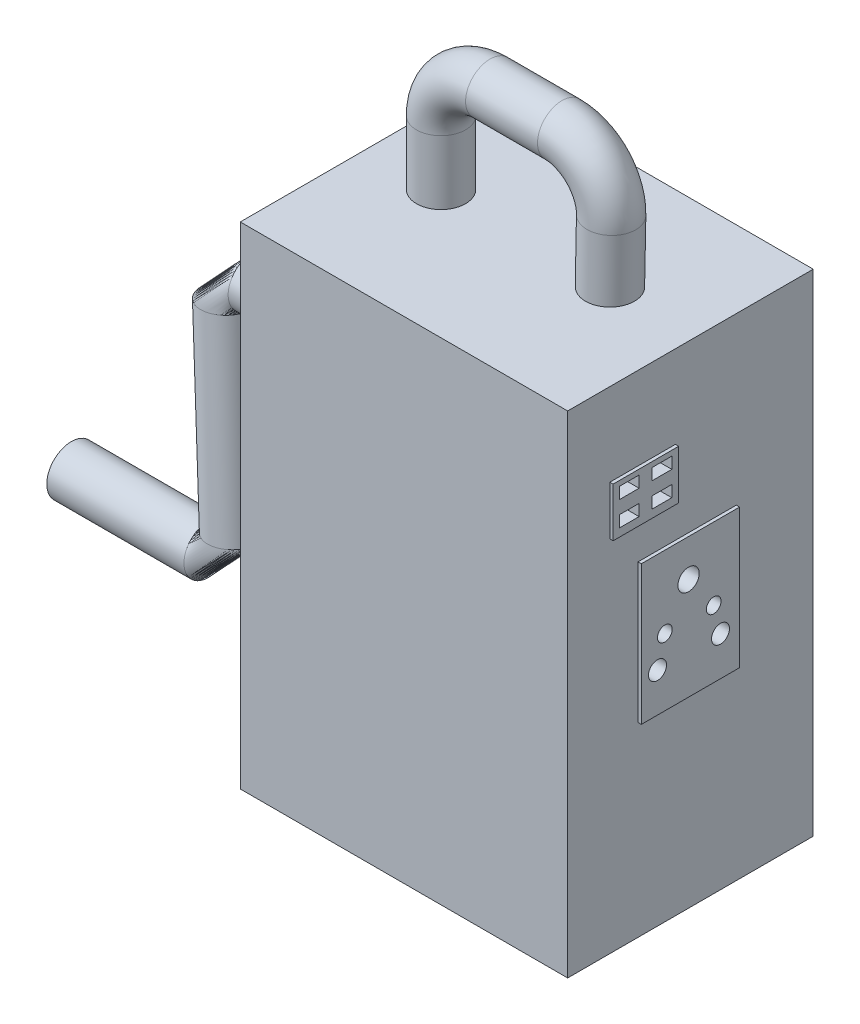
from build123d import *

# Parameters (mm, degrees)
SKETCH1_W            = 200
SKETCH1_H            = 150
BOSS_EXTRUDE1_DEPTH  = 300
SKETCH2_R            = 10
BOSS_EXTRUDE2_DEPTH  = 10
LPATTERN1_COUNT      = 2
LPATTERN1_PITCH      = 135
LPATTERN1_COUNT_DIR2 = 2
LPATTERN1_PITCH_DIR2 = 95
SKETCH3_W            = 60
SKETCH3_H            = 85
BOSS_EXTRUDE3_DEPTH  = 2
SKETCH4_R            = 6.5
SKETCH4_R_2          = 4.5
SKETCH4_R_3          = 5.5
CUT_EXTRUDE1_DEPTH   = 10
SKETCH5_W            = 40
SKETCH5_H            = 30
BOSS_EXTRUDE4_DEPTH  = 2
SKETCH6_W            = 12
SKETCH6_H            = 7
CUT_EXTRUDE2_DEPTH   = 10
LPATTERN2_COUNT      = 2
LPATTERN2_PITCH      = 20
LPATTERN2_COUNT_DIR2 = 2
LPATTERN2_PITCH_DIR2 = 15
SWEEP1_PROFILE_R     = 15
SWEEP3_PROFILE_R     = 15


with BuildPart() as part:
    # Sketch1 → Boss-Extrude1 (new body)
    with BuildSketch(Plane(origin=(0, 0, 0), x_dir=(1, 0, 0), z_dir=(0, 1, 0))):
        with Locations((100, 75)):
            Rectangle(SKETCH1_W, SKETCH1_H)
    extrude(amount=BOSS_EXTRUDE1_DEPTH)

    # Sketch2 → Boss-Extrude2 (add)
    with BuildSketch(Plane.XZ):
        with Locations(Location((30, -30, 0), (0, 0, 270))):
            Circle(SKETCH2_R)
    boss_extrude2 = extrude(amount=BOSS_EXTRUDE2_DEPTH)

    # LPattern1: Boss-Extrude2 2 × 2
    with Locations(*[(i * LPATTERN1_PITCH, 0, -j * LPATTERN1_PITCH_DIR2) for i in range(LPATTERN1_COUNT) for j in range(LPATTERN1_COUNT_DIR2) if (i, j) != (0, 0)]):
        add(boss_extrude2)

    # Sketch3 → Boss-Extrude3 (add)
    with BuildSketch(Plane(origin=(200, 0, 0), x_dir=(0, 0, -1), z_dir=(1, 0, 0))):
        with Locations((73, 156.159254336)):
            Rectangle(SKETCH3_W, SKETCH3_H)
    extrude(amount=BOSS_EXTRUDE3_DEPTH)

    # Sketch4 → Cut-Extrude1 (cut)
    with BuildSketch(Plane(origin=(202, 0, 0), x_dir=(0, 0, -1), z_dir=(1, 0, 0))):
        with Locations((71.853020993, 175.943431477)):
            Circle(SKETCH4_R)
        with Locations((57.356733942, 154.567450344)):
            Circle(SKETCH4_R_2)
        with Locations((87.212182272, 154.567450344)):
            Circle(SKETCH4_R_2)
        with Locations((52.869787951, 137.459240855)):
            Circle(SKETCH4_R_3)
        with Locations((91.353978572, 137.459240855)):
            Circle(SKETCH4_R_3)
    extrude(amount=-CUT_EXTRUDE1_DEPTH, mode=Mode.SUBTRACT)

    # Sketch5 → Boss-Extrude4 (add)
    with BuildSketch(Plane(origin=(200, 0, 0), x_dir=(0, 0, -1), z_dir=(1, 0, 0))):
        with Locations((45.757145197, 234.416332146)):
            Rectangle(SKETCH5_W, SKETCH5_H)
    extrude(amount=BOSS_EXTRUDE4_DEPTH)

    # Sketch6 → Cut-Extrude2 (cut)
    with BuildSketch(Plane(origin=(202, 0, 0), x_dir=(0, 0, -1), z_dir=(1, 0, 0))):
        with Locations((35.621192249, 242.789266553)):
            Rectangle(SKETCH6_W, SKETCH6_H)
    cut_extrude2 = extrude(amount=-CUT_EXTRUDE2_DEPTH, mode=Mode.SUBTRACT)

    # LPattern2: Cut-Extrude2 2 × 2
    with Locations(*[(0, -j * LPATTERN2_PITCH_DIR2, -i * LPATTERN2_PITCH) for i in range(LPATTERN2_COUNT) for j in range(LPATTERN2_COUNT_DIR2) if (i, j) != (0, 0)]):
        add(cut_extrude2, mode=Mode.SUBTRACT)

    # Sweep1: sweep along a curve in space
    with BuildLine() as sweep1_path:
        Line((44.183408536, 300, -78.446799091), (44.183408536, 339.05786042, -78.446799091))
        ThreePointArc((44.183408536, 339.05786042, -78.446799091), (52.970205101, 360.271063856, -78.446799091), (74.183408536, 369.05786042, -78.446799091))
        Line((74.183408536, 369.05786042, -78.446799091), (118.129151449, 369.05786042, -78.446799091))
        ThreePointArc((118.129151449, 369.05786042, -78.446799091), (139.550389075, 360.060969204, -78.446799091), (148.123323724, 338.466565659, -78.446799091))
        Line((148.123323724, 338.466565659, -78.446799091), (147.365007124, 300, -78.446799091))
    # Sweep1 profile (on start of the path) → Sweep1 (sweep)
    with BuildSketch(Plane(origin=(44.183408536, 300, -78.446799091), x_dir=(0, 0, 1), z_dir=(0, 1, 0))):
        Circle(SWEEP1_PROFILE_R)
    sweep(path=sweep1_path.line)

    # Sweep3: sweep along a curve in space
    with BuildLine() as sweep3_path:
        Line((0, 196.29190753, -76.403481412), (-68.808571034, 196.29190753, -76.403481412))
        ThreePointArc((-68.808571034, 196.29190753, -76.403481412), (-79.81229202, 191.489875152, -76.208825939), (-83.764863748, 180.160905025, -75.749594126))
        Line((-83.764863748, 180.160905025, -75.749594126), (-74.792635523, 62.982710481, -70.999651793))
        ThreePointArc((-74.792635523, 62.982710481, -70.999651793), (-78.745207251, 51.653740354, -70.540419979), (-89.748928238, 46.851707976, -70.345764506))
        Line((-89.748928238, 46.851707976, -70.345764506), (-173.557499271, 46.851707976, -70.345764506))
    # Sweep3 profile (on start of the path) → Sweep3 (sweep)
    with BuildSketch(Plane(origin=(0, 196.29190753, -76.403481412), x_dir=(0, 0, -1), z_dir=(-1, 0, 0))):
        Circle(SWEEP3_PROFILE_R)
    sweep(path=sweep3_path.line)


solid = part.part
